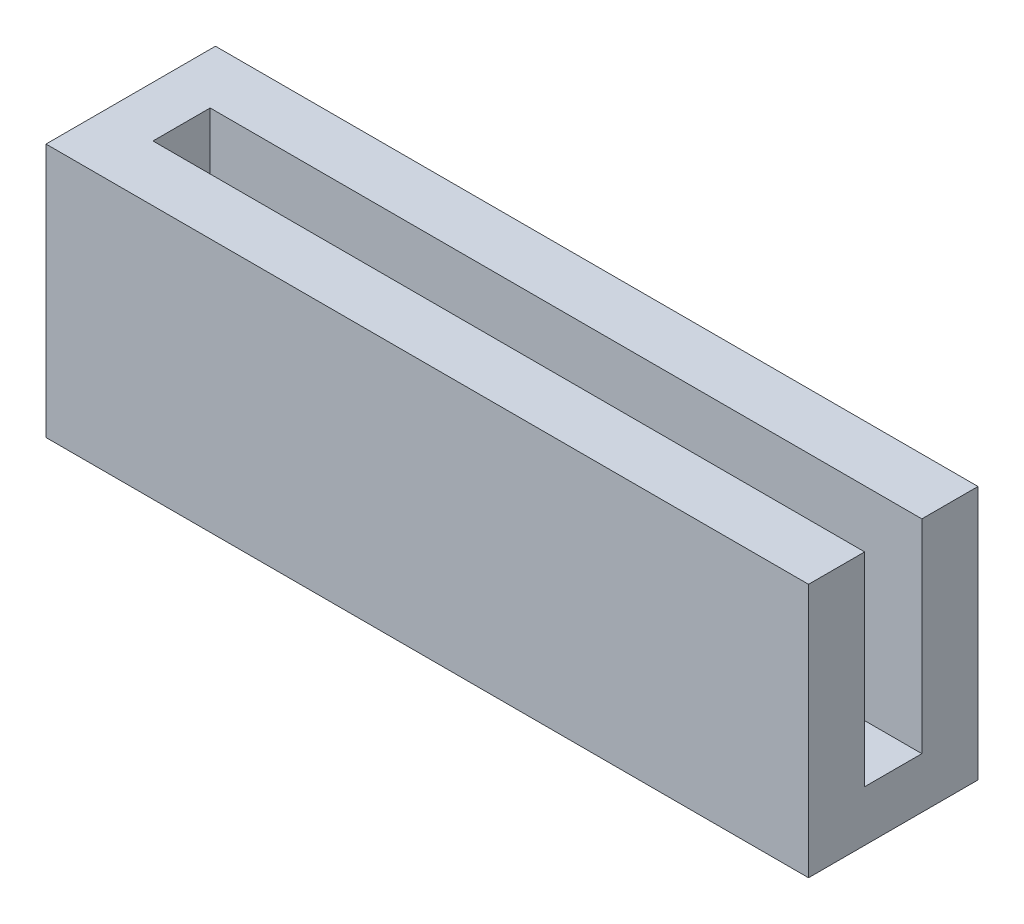
from build123d import *

# Parameters (mm, degrees)
SKETCH2_W           = 45
SKETCH2_H           = 15
BOSS_EXTRUDE1_DEPTH = 5
SKETCH3_W           = 42
SKETCH3_H           = 3.375
CUT_EXTRUDE1_DEPTH  = 12


with BuildPart() as part:
    # Sketch2 → Boss-Extrude1 (new, symmetric)
    with BuildSketch(Plane.XY):
        with Locations((22.5, 7.5)):
            Rectangle(SKETCH2_W, SKETCH2_H)
    extrude(amount=BOSS_EXTRUDE1_DEPTH, both=True)

    # Sketch3 → Cut-Extrude1 (cut)
    with BuildSketch(Plane(origin=(0, 15, 0), x_dir=(1, 0, 0), z_dir=(0, 1, 0))):
        with Locations((24, 0)):
            Rectangle(SKETCH3_W, SKETCH3_H)
    extrude(amount=-CUT_EXTRUDE1_DEPTH, mode=Mode.SUBTRACT)


solid = part.part
